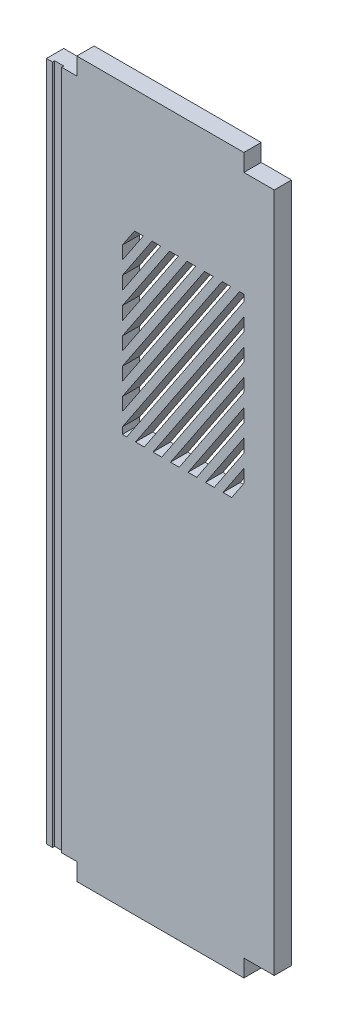
from build123d import *

# Parameters (mm, degrees)
SKETCH1_W           = 75
SKETCH1_H           = 235.4
BOSS_EXTRUDE1_DEPTH = 5.7
SKETCH2_W           = 10
SKETCH2_H           = 5.7
CUT_EXTRUDE1_DEPTH  = 5.7
CUT_EXTRUDE2_DEPTH  = 5.7
SKETCH4_W           = 3
SKETCH4_H           = 224
CUT_EXTRUDE3_DEPTH  = 0.7


with BuildPart() as part:
    # Sketch1 → Boss-Extrude1 (new body)
    with BuildSketch(Plane.XY):
        with Locations((37.5, 117.7)):
            Rectangle(SKETCH1_W, SKETCH1_H)
    extrude(amount=BOSS_EXTRUDE1_DEPTH)

    # Sketch2 → Cut-Extrude1 (cut)
    with BuildSketch(Plane(origin=(0, 0, 0), x_dir=(-1, 0, 0), z_dir=(0, 0, -1))):
        with Locations((-70, 2.85)):
            Rectangle(SKETCH2_W, SKETCH2_H)
        with Locations((-5, 2.85)):
            Rectangle(SKETCH2_W, SKETCH2_H)
        with Locations((-5, 232.55)):
            Rectangle(SKETCH2_W, SKETCH2_H)
        with Locations((-70, 232.55)):
            Rectangle(SKETCH2_W, SKETCH2_H)
    extrude(amount=-CUT_EXTRUDE1_DEPTH, mode=Mode.SUBTRACT)

    # Sketch3 → Cut-Extrude2 (cut)
    with BuildSketch(Plane.XY.offset(5.7)):
        Polygon((65, 195), (63.55777949, 195), (25, 137.163330765), (25, 135), (26.44222051, 135), (65, 192.836669235), align=None)
        Polygon((60.67777949, 195), (57.79777949, 195), (25, 145.803330765), (25, 141.483330765), align=None)
        Polygon((54.91777949, 195), (52.03777949, 195), (25, 154.443330765), (25, 150.123330765), align=None)
        Polygon((49.15777949, 195), (46.27777949, 195), (25, 163.083330765), (25, 158.763330765), align=None)
        Polygon((43.39777949, 195), (40.51777949, 195), (25, 171.723330765), (25, 167.403330765), align=None)
        Polygon((37.63777949, 195), (34.75777949, 195), (25, 180.363330765), (25, 176.043330765), align=None)
        Polygon((31.87777949, 195), (28.99777949, 195), (25, 189.003330765), (25, 184.683330765), align=None)
        Polygon((65, 184.196669235), (65, 188.516669235), (29.32222051, 135), (32.20222051, 135), align=None)
        Polygon((65, 175.556669235), (65, 179.876669235), (35.08222051, 135), (37.96222051, 135), align=None)
        Polygon((65, 166.916669235), (65, 171.236669235), (40.84222051, 135), (43.72222051, 135), align=None)
        Polygon((65, 158.276669235), (65, 162.596669235), (46.60222051, 135), (49.48222051, 135), align=None)
        Polygon((65, 149.636669235), (65, 153.956669235), (52.36222051, 135), (55.24222051, 135), align=None)
        Polygon((65, 140.996669235), (65, 145.316669235), (58.12222051, 135), (61.00222051, 135), align=None)
    extrude(amount=-CUT_EXTRUDE2_DEPTH, mode=Mode.SUBTRACT)

    # Sketch4 → Cut-Extrude3 (cut)
    with BuildSketch(Plane.XY.offset(5.7)):
        with Locations((3.5, 117.7)):
            Rectangle(SKETCH4_W, SKETCH4_H)
    extrude(amount=-CUT_EXTRUDE3_DEPTH, mode=Mode.SUBTRACT)


solid = part.part
